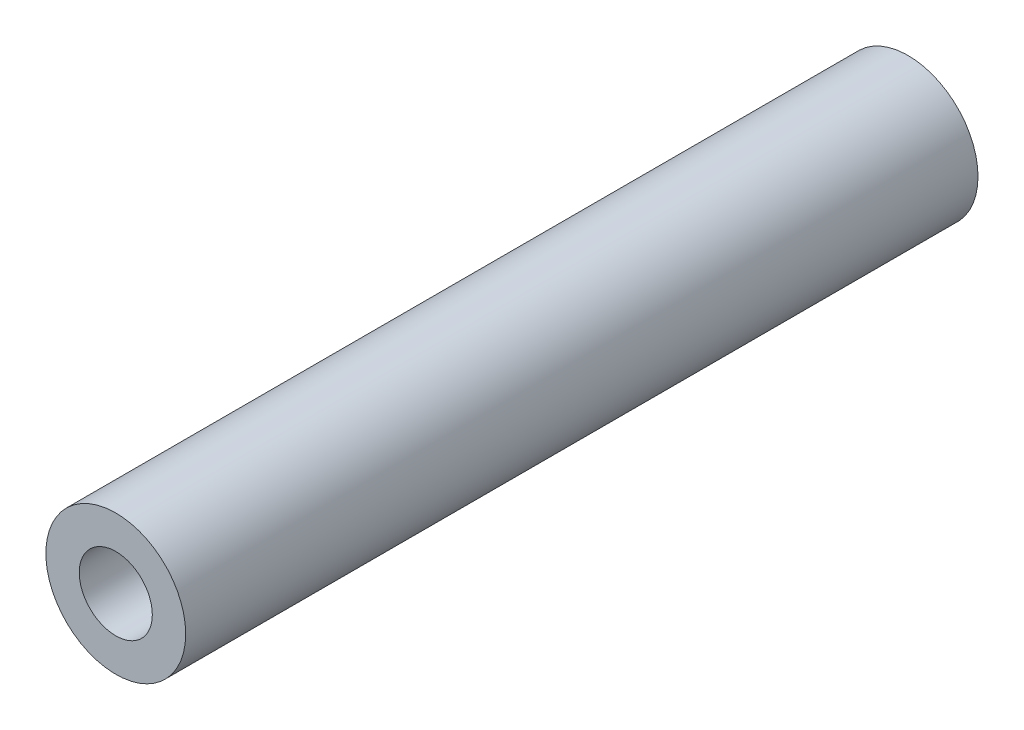
from build123d import *

# Parameters (mm, degrees)
SKETCH1_R           = 4.7625
SKETCH1_R_2         = 2.4892
BOSS_EXTRUDE1_DEPTH = 26.9875


with BuildPart() as part:
    # Sketch1 → Boss-Extrude1 (new, symmetric)
    with BuildSketch(Plane.XY):
        Circle(SKETCH1_R)
        Circle(SKETCH1_R_2, mode=Mode.SUBTRACT)
    extrude(amount=BOSS_EXTRUDE1_DEPTH, both=True)


solid = part.part
